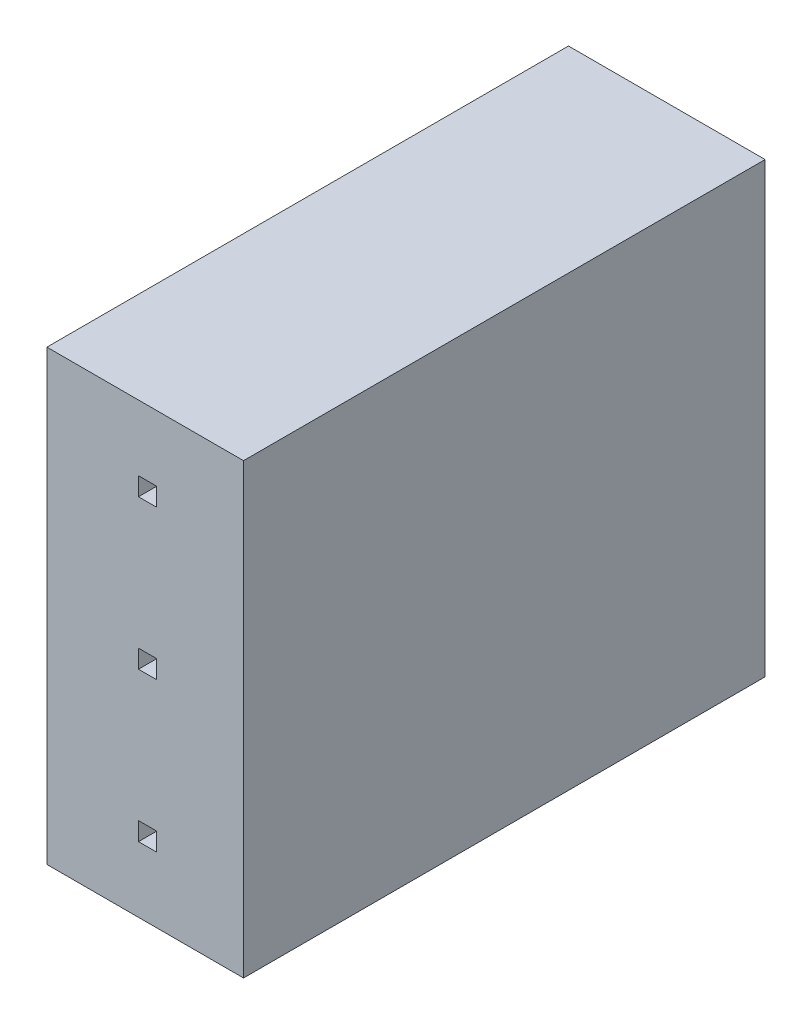
from build123d import *

# Parameters (mm, degrees)
SKETCH2_W           = 3.77
SKETCH2_H           = 8.59
SKETCH2_W_2         = 0.35
SKETCH2_H_2         = 0.35
BOSS_EXTRUDE1_DEPTH = 10


with BuildPart() as part:
    # Sketch2 → Boss-Extrude1 (new body)
    with BuildSketch(Plane(origin=(0, 0, 0), x_dir=(-1, 0, 0), z_dir=(0, 0, 1))):
        with Locations((0.045949122, 0)):
            Rectangle(SKETCH2_W, SKETCH2_H)
        with Locations((0, -2.8633)):
            Rectangle(SKETCH2_W_2, SKETCH2_H_2, mode=Mode.SUBTRACT)
        Rectangle(SKETCH2_W_2, SKETCH2_H_2, mode=Mode.SUBTRACT)
        with Locations((0, 2.8633)):
            Rectangle(SKETCH2_W_2, SKETCH2_H_2, mode=Mode.SUBTRACT)
    extrude(amount=BOSS_EXTRUDE1_DEPTH)


solid = part.part
